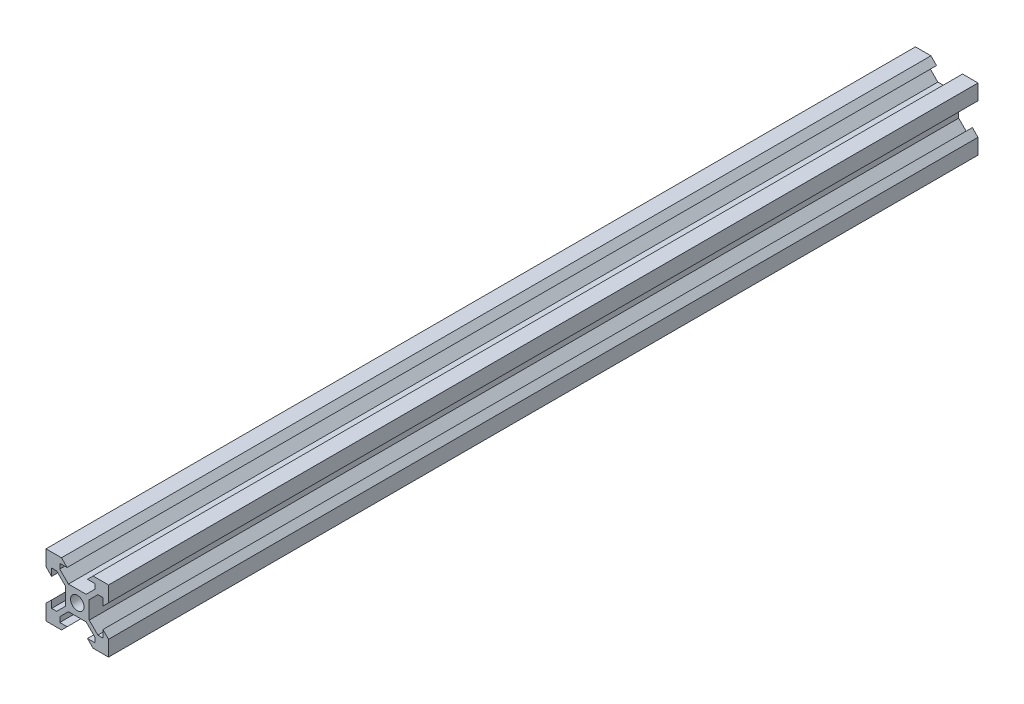
from build123d import *

# Parameters (mm, degrees)
CROQUIS1_R              = 2.15
SALIENTE_EXTRUIR2_DEPTH = 278


with BuildPart() as part:
    # Croquis1 → Saliente-Extruir2 (new body)
    with BuildSketch(Plane.XY):
        Polygon((4.4, 0), (0, 0), (0, -0.56736664), (0, -4.4), (0, -4.95), (1.8, -6.75), (1.8, -4.4), (3.410050506, -4.4), (6.175, -7.164949494), (6.175, -12.835050506), (3.410050506, -15.6), (1.8, -15.6), (1.8, -13.25), (0, -15.05), (0, -15.6), (0, -20), (4.4, -20), (4.95, -20), (6.75, -18.2), (4.4, -18.2), (4.4, -16.589949494), (7.164949494, -13.825), (12.835050506, -13.825), (15.6, -16.589949494), (15.6, -18.2), (13.25, -18.2), (15.05, -20), (15.6, -20), (18.2, -20), (20, -20), (20, -15.6), (20, -15.05), (18.2, -13.25), (18.2, -15.6), (16.589949494, -15.6), (13.825, -12.835050506), (13.825, -7.164949494), (16.589949494, -4.4), (18.2, -4.4), (18.2, -6.75), (20, -4.95), (20, -4.4), (20, 0), (15.6, 0), (15.05, 0), (13.25, -1.8), (15.6, -1.8), (15.6, -3.410050506), (12.835050506, -6.175), (7.164949494, -6.175), (4.4, -3.410050506), (4.4, -1.8), (6.75, -1.8), (4.95, 0), align=None)
        with Locations((10, -10)):
            Circle(CROQUIS1_R, mode=Mode.SUBTRACT)
    extrude(amount=SALIENTE_EXTRUIR2_DEPTH)


solid = part.part
